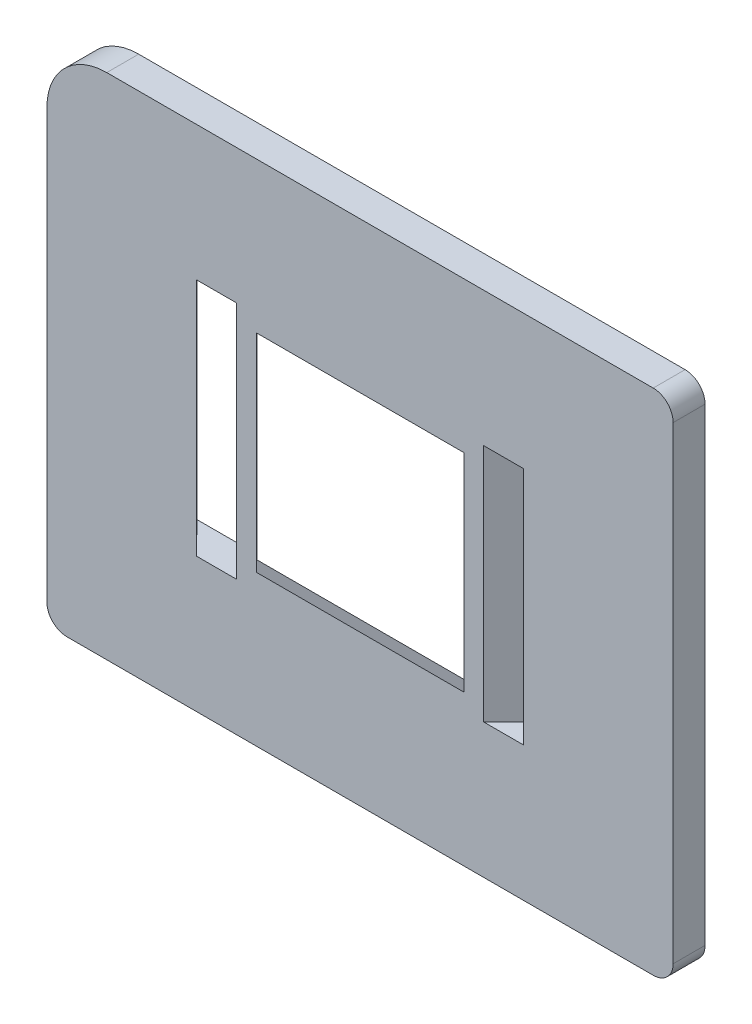
from build123d import *
from OCP.BRepFilletAPI import BRepFilletAPI_MakeFillet

# Parameters (mm, degrees)
SKETCH1_W           = 157
SKETCH1_H           = 127.5
BOSS_EXTRUDE1_DEPTH = 4
FILLET1_R1          = 15
FILLET1_R2          = 5


with BuildPart() as part:
    # Sketch1 → Boss-Extrude1 (new, symmetric)
    with BuildSketch(Plane.XY):
        Rectangle(SKETCH1_W, SKETCH1_H)
    extrude(amount=BOSS_EXTRUDE1_DEPTH, both=True)

    # Sketch2 → Cut-Loft1 section 0
    with BuildSketch(Plane.XY.offset(4)):
        with BuildLine():
            Line((-26, -26), (26, -26))
            Line((26, -26), (26, 26))
            Line((26, 26), (-26, 26))
            Line((-26, 26), (-26, -26))
        make_face()
    # Sketch4 → Cut-Loft1 section 1
    with BuildSketch(Plane.XY.offset(-34)):
        with BuildLine():
            Line((63.5, -50.8), (-63.5, -50.8))
            Line((-63.5, -50.8), (-63.5, 50.8))
            Line((-63.5, 50.8), (63.5, 50.8))
            Line((63.5, 50.8), (63.5, -50.8))
        make_face()
    loft(mode=Mode.SUBTRACT)

    # Sketch5 → Cut-Loft2 section 0
    with BuildSketch(Plane.XY.offset(4)):
        with BuildLine():
            Line((-31, 30), (-41, 30))
            Line((-41, 30), (-41, -30))
            Line((-41, -30), (-31, -30))
            Line((-31, -30), (-31, 30))
        make_face()
    # Sketch6 → Cut-Loft2 section 1
    with BuildSketch(Plane(origin=(0, 0, -4), x_dir=(-1, 0, 0), z_dir=(0, 0, -1))):
        with BuildLine():
            Line((38.894736842, 30), (48.894736842, 30))
            Line((48.894736842, 30), (48.894736842, -30))
            Line((48.894736842, -30), (38.894736842, -30))
            Line((38.894736842, -30), (38.894736842, 30))
        make_face()
    cut_loft2 = loft(mode=Mode.SUBTRACT)

    # Mirror1: Cut-Loft2 across plane
    add(cut_loft2.mirror(Plane(origin=(0, 0, 0), x_dir=(0, 0, 1), z_dir=(1, 0, 0))), mode=Mode.SUBTRACT)

    # Fillet1: one fillet with a radius per group of edges: ONE call of the kernel's fillet builder (fillet() takes one radius for all edges)
    fillet1_edges_1 = [part.edges().sort_by_distance(p)[0] for p in [
        (-78.5, 63.75, 0),
    ]]
    fillet1_edges_2 = [part.edges().sort_by_distance(p)[0] for p in [
        (78.5, 63.75, 0),
        (78.5, -63.75, 0),
        (-78.5, -63.75, 0),
    ]]
    fillet1 = BRepFilletAPI_MakeFillet(part.part.solid().wrapped)
    for e in fillet1_edges_1:
        fillet1.Add(FILLET1_R1, e.wrapped)
    for e in fillet1_edges_2:
        fillet1.Add(FILLET1_R2, e.wrapped)
    add(Compound.cast(fillet1.Shape()), mode=Mode.REPLACE)


solid = part.part
